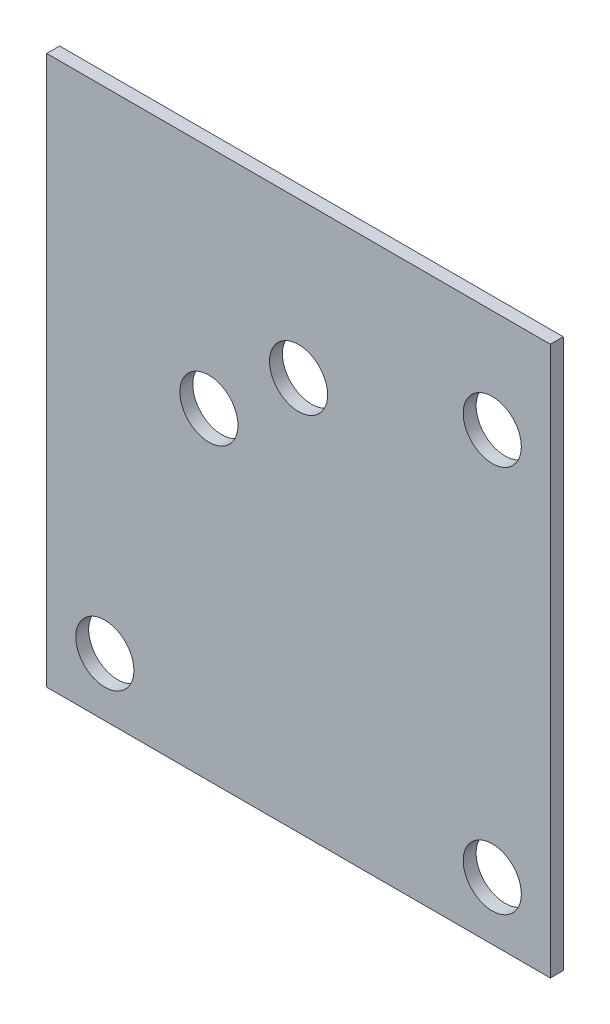
from build123d import *

# Parameters (mm, degrees)
SKETCH1_W                      = 247.65
SKETCH1_H                      = 269.875
SKETCH1_R                      = 14.2875
I_CAN_CHANGE_THESE_NAMES_DEPTH = 6.35


with BuildPart() as part:
    # Sketch1 → I CAN CHANGE THESE NAMES?! (new body)
    with BuildSketch(Plane.XY):
        with Locations((-95.25, 106.3625)):
            Rectangle(SKETCH1_W, SKETCH1_H)
        Circle(SKETCH1_R, mode=Mode.SUBTRACT)
        with Locations((-190.5, 0)):
            Circle(SKETCH1_R, mode=Mode.SUBTRACT)
        with Locations((-139.322880158, 129.920687592)):
            Circle(SKETCH1_R, mode=Mode.SUBTRACT)
        with Locations((-95.25, 164.977839421)):
            Circle(SKETCH1_R, mode=Mode.SUBTRACT)
        with Locations((0, 190.5)):
            Circle(SKETCH1_R, mode=Mode.SUBTRACT)
    extrude(amount=I_CAN_CHANGE_THESE_NAMES_DEPTH)


solid = part.part
